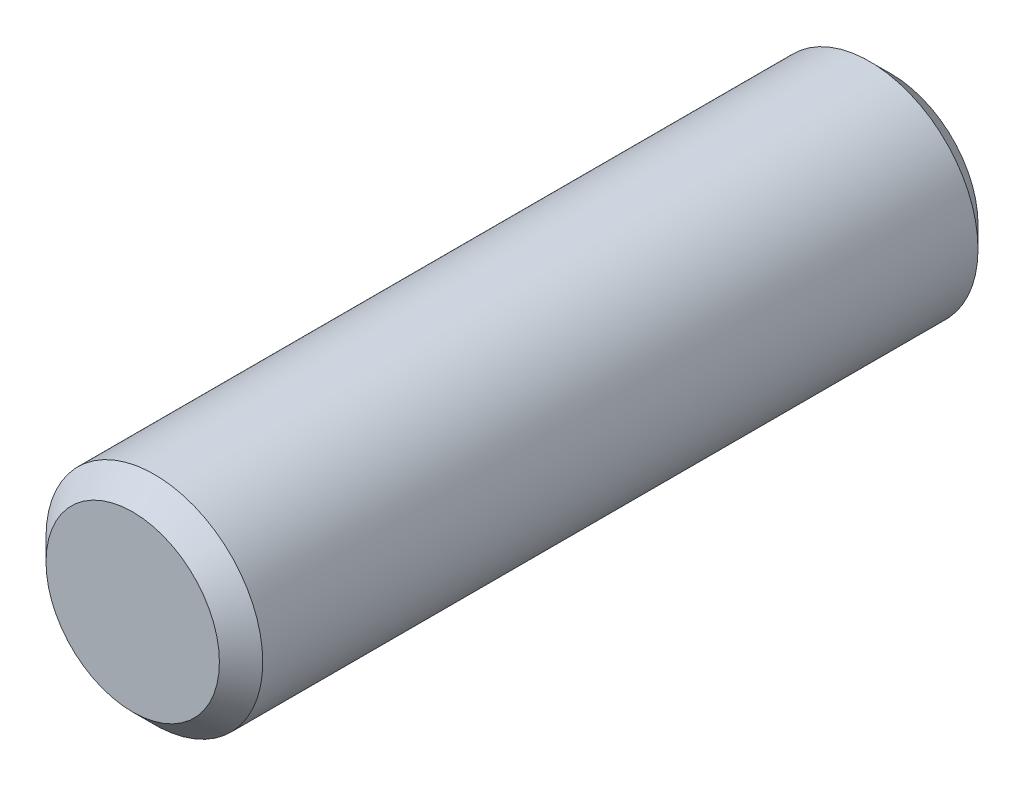
from build123d import *

# Parameters (mm, degrees)
IZIM2_R                     = 10
Y_KSEKLIK_EKSTR_ZYON1_DEPTH = 35
PAH1_SIZE                   = 2


with BuildPart() as part:
    # Çizim2 → Yükseklik-Ekstrüzyon1 (new, symmetric)
    with BuildSketch(Plane.XY):
        Circle(IZIM2_R)
    extrude(amount=Y_KSEKLIK_EKSTR_ZYON1_DEPTH, both=True)

    # Pah1
    pah1_edges = [part.edges().sort_by_distance(p)[0] for p in [
        (-10, 0, -35),
        (-10, 0, 35),
    ]]
    chamfer(pah1_edges, length=PAH1_SIZE)


solid = part.part
